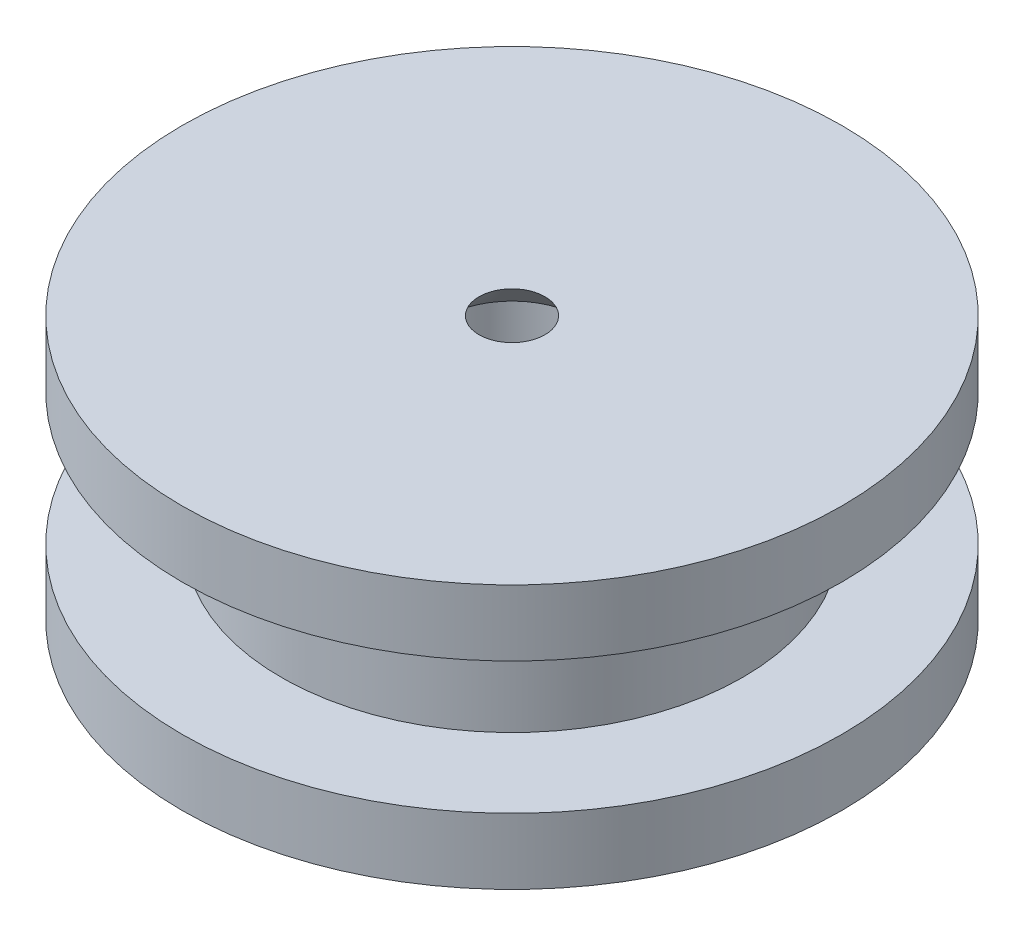
from build123d import *


with BuildPart() as part:
    # Sketch2 → Revolve1 (revolve)
    with BuildSketch(Plane.XY, mode=Mode.PRIVATE) as revolve1_sk:
        Polygon((-0.5, 2), (-5, 2), (-5, 1), (-3.5, 1), (-3.5, -1), (-5, -1), (-5, -2), (-1.05, -2), (-1.05, 1.45), align=None)
    revolve(revolve1_sk.sketch.rotate(Axis((0, -2, 0), (0, 1, 0)), 180), axis=Axis((0, -2, 0), (0, 1, 0)))


solid = part.part
